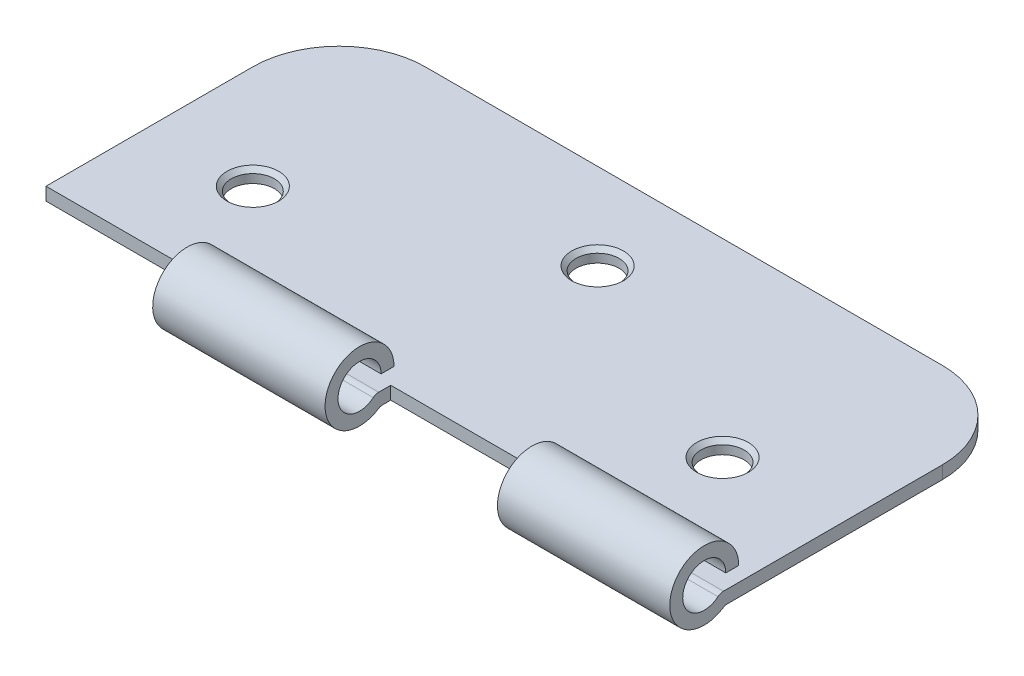
from build123d import *

# Parameters (mm, degrees)
BOSS_EXTRUDE1_DEPTH = 1.5
BOSS_EXTRUDE2_DEPTH = 20
LPATTERN1_COUNT     = 2
LPATTERN1_PITCH     = 40
SKETCH6_R           = 2.5
CUT_EXTRUDE1_DEPTH  = 20
CHAMFER2_SIZE       = 0.5


with BuildPart() as part:
    # Sketch1 → Boss-Extrude1 (new body)
    with BuildSketch(Plane(origin=(0, 0, 0), x_dir=(1, 0, 0), z_dir=(0, 1, 0))):
        with BuildLine():
            Line((-30, 17), (30, 17))
            ThreePointArc((30, 17), (37.071067812, 14.071067812), (40, 7))
            Line((40, 7), (40, -17))
            Line((40, -17), (-40, -17))
            Line((-40, -17), (-40, 7))
            ThreePointArc((-40, 7), (-37.071067812, 14.071067812), (-30, 17))
        make_face()
    extrude(amount=BOSS_EXTRUDE1_DEPTH)

    # Sketch3 → Boss-Extrude2 (add)
    with BuildSketch(Plane(origin=(40, 0, 0), x_dir=(0, 0, -1), z_dir=(1, 0, 0))):
        with BuildLine():
            Line((-17, 0), (-17.907653586, 0))
            ThreePointArc((-17.907653586, 0), (-18.19052708, -0.040842773), (-18.450293899, -0.160034828))
            ThreePointArc((-18.450293899, -0.160034828), (-24.133848537, 5.112645111), (-16.620855154, 3.199825859))
            Line((-16.620855154, 3.199825859), (-18.120855154, 3.199825859))
            ThreePointArc((-18.120855154, 3.199825859), (-22.882198948, 4.265810965), (-19.02991455, 1.271378817))
            ThreePointArc((-19.02991455, 1.271378817), (-18.731636803, 1.441110731), (-18.393538309, 1.5))
            Line((-18.393538309, 1.5), (-17, 1.5))
            Line((-17, 1.5), (-17, 0))
        make_face()
    boss_extrude2 = extrude(amount=-BOSS_EXTRUDE2_DEPTH)

    # LPattern1: Boss-Extrude2 ×2
    with Locations(*[(-i * LPATTERN1_PITCH, 0, 0) for i in range(1, LPATTERN1_COUNT)]):
        add(boss_extrude2)

    # Sketch6 → Cut-Extrude1 (cut)
    with BuildSketch(Plane(origin=(0, 1.5, 0), x_dir=(1, 0, 0), z_dir=(0, 1, 0))):
        with Locations(Location((-28, -5, 0), (0, 0, 270))):
            Circle(SKETCH6_R)
        with Locations(Location((0, 7, 0), (0, 0, 270))):
            Circle(SKETCH6_R)
        with Locations(Location((26.5, -5, 0), (0, 0, 270))):
            Circle(SKETCH6_R)
    extrude(amount=-CUT_EXTRUDE1_DEPTH, mode=Mode.SUBTRACT)

    # Chamfer2
    chamfer2_edges = [part.edges().sort_by_distance(p)[0] for p in [
        (-28, 1.5, 2.5),
        (0, 1.5, -9.5),
        (26.5, 1.5, 2.5),
    ]]
    chamfer(chamfer2_edges, length=CHAMFER2_SIZE)


solid = part.part
